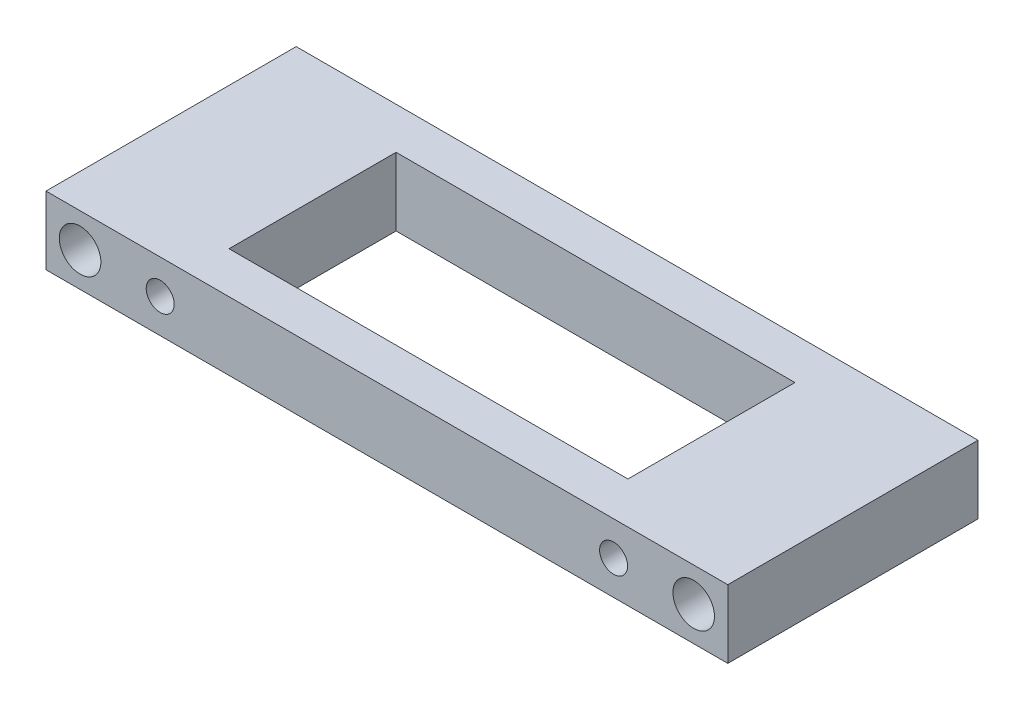
from build123d import *

# Parameters (mm, degrees)
SKETCH1_W           = 100
SKETCH1_H           = 20
SKETCH1_R           = 6.1
SKETCH1_R_2         = 4.1
BOSS_EXTRUDE1_DEPTH = 40
SKETCH2_W           = 100
SKETCH2_H           = 20
BOSS_EXTRUDE2_DEPTH = 33.4
CUT_EXTRUDE1_REACH  = 111.545
SKETCH3_W           = 58.5
SKETCH3_H           = 49


with BuildPart() as part:
    # Sketch1 → Boss-Extrude1 (new body)
    with BuildSketch(Plane.XY):
        with Locations((-50, 10)):
            Rectangle(SKETCH1_W, SKETCH1_H)
        with Locations((-90, 10)):
            Circle(SKETCH1_R, mode=Mode.SUBTRACT)
        with Locations((-66.5, 10)):
            Circle(SKETCH1_R_2, mode=Mode.SUBTRACT)
    boss_extrude1 = extrude(amount=BOSS_EXTRUDE1_DEPTH)

    # Sketch2 → Boss-Extrude2 (add)
    with BuildSketch(Plane(origin=(0, 0, 0), x_dir=(-1, 0, 0), z_dir=(0, 0, -1))):
        with Locations((50, 10)):
            Rectangle(SKETCH2_W, SKETCH2_H)
    boss_extrude2 = extrude(amount=BOSS_EXTRUDE2_DEPTH)

    # Sketch3 → Cut-Extrude1 (cut, up to next)
    with BuildSketch(Plane(origin=(0, 20, 0), x_dir=(1, 0, 0), z_dir=(0, 1, 0)), mode=Mode.PRIVATE) as cut_extrude1_sk1:
        with Locations((-29.25, -3.3)):
            Rectangle(SKETCH3_W, SKETCH3_H)
    cut_extrude1_tool1 = extrude(cut_extrude1_sk1.sketch, amount=-CUT_EXTRUDE1_REACH, mode=Mode.PRIVATE) & part.part
    cut_extrude1 = cut_extrude1_tool1.solids().sort_by_distance((-29.25, 20, 3.3))[0]
    add(cut_extrude1, mode=Mode.SUBTRACT)

    # Mirror2: Boss-Extrude1, Boss-Extrude2, Cut-Extrude1 across plane
    add(boss_extrude1.mirror(Plane(origin=(0, 0, 40), x_dir=(0, 0, 1), z_dir=(-1, 0, 0))))
    add(boss_extrude2.mirror(Plane(origin=(0, 0, 40), x_dir=(0, 0, 1), z_dir=(-1, 0, 0))))
    add(cut_extrude1.mirror(Plane(origin=(0, 0, 40), x_dir=(0, 0, 1), z_dir=(-1, 0, 0))), mode=Mode.SUBTRACT)


solid = part.part
